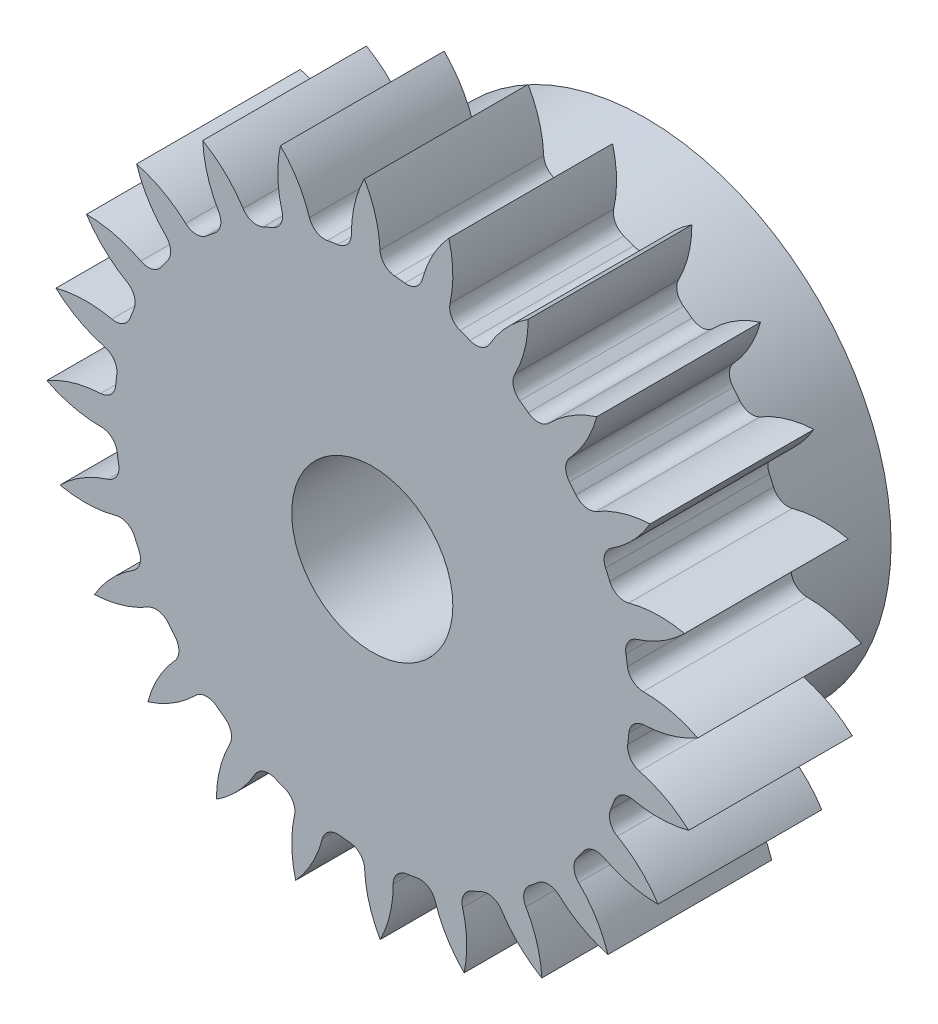
from build123d import *

# Parameters (mm, degrees)
SKETCH3_R         = 55
GEARBODY_DEPTH    = 25.4
TOOTHCUT_DEPTH    = 82.823957372
CIRPATTERN1_COUNT = 24
HUB1DIA_R         = 38.099998474
HUB1_DEPTH        = 17
BOREDIA_R         = 12.5
BORE_DEPTH        = 12700


with BuildPart() as part:
    # Sketch3 → gearBody (new body)
    with BuildSketch(Plane.XY):
        Circle(SKETCH3_R)
    extrude(amount=GEARBODY_DEPTH)

    # Sketch2 → toothCut (cut, through all)
    with BuildSketch(Plane.XY):
        with BuildLine():
            ThreePointArc((39.63325451, -5.054031518), (39.727241201, -4.252576179), (39.805022707, -3.449386166))
            ThreePointArc((39.805022707, -3.449386166), (40.555726083, -1.881383212), (42.154127252, -1.197787917))
            ThreePointArc((42.154127252, -1.197787917), (50.270434683, 1.101841474), (56.499016894, 6.791086179))
            ThreePointArc((56.499016894, 6.791086179), (56.582440511, -6.056829807), (53.781474359, -18.595988204))
            ThreePointArc((53.781474359, -18.595988204), (48.898219868, -11.717284312), (41.45255376, -7.751833786))
            ThreePointArc((41.45255376, -7.751833786), (40.0350602, -6.745404041), (39.63325451, -5.054031518))
        make_face()
    toothcut = extrude(amount=TOOTHCUT_DEPTH, mode=Mode.SUBTRACT)

    # CirPattern1: toothCut ×24 about axis
    cirpattern1_axis = Axis((0, 0, 0), (0, 0, 1))
    for i in range(1, CIRPATTERN1_COUNT):
        add(toothcut.rotate(cirpattern1_axis, i * 360 / CIRPATTERN1_COUNT), mode=Mode.SUBTRACT)

    # hub1Dia → hub1 (add)
    with BuildSketch(Plane(origin=(0, 0, 0), x_dir=(-1, 0, 0), z_dir=(0, 0, -1))):
        with Locations(Location((0, 0, 0), (0, 0, 180))):
            Circle(HUB1DIA_R)
    extrude(amount=HUB1_DEPTH)

    # boreDia → bore (cut, symmetric)
    with BuildSketch(Plane.XY):
        Circle(BOREDIA_R)
    extrude(amount=BORE_DEPTH, both=True, mode=Mode.SUBTRACT)


solid = part.part
